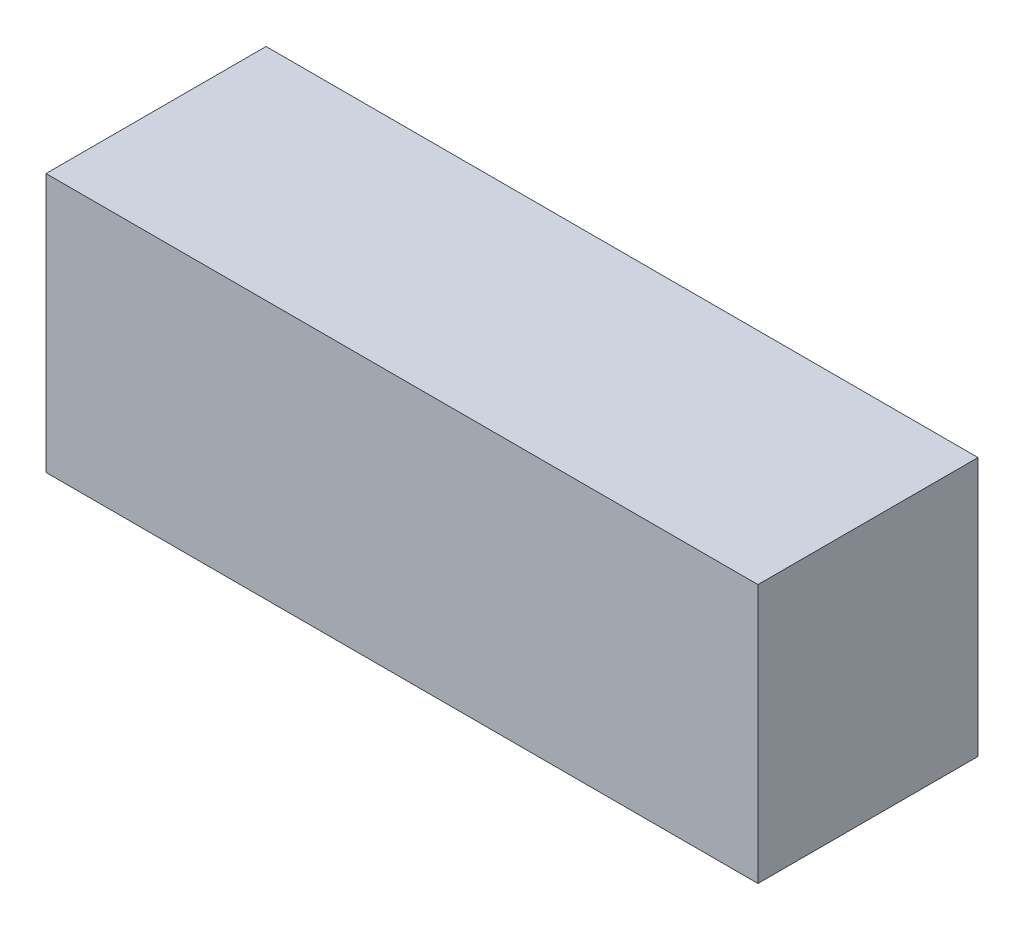
from build123d import *

# Parameters (mm, degrees)
SKETCH1_W           = 55
SKETCH1_H           = 17
BOSS_EXTRUDE1_DEPTH = 20


with BuildPart() as part:
    # Sketch1 → Boss-Extrude1 (new body)
    with BuildSketch(Plane(origin=(0, 0, 0), x_dir=(1, 0, 0), z_dir=(0, 1, 0))):
        Rectangle(SKETCH1_W, SKETCH1_H)
    extrude(amount=BOSS_EXTRUDE1_DEPTH)


solid = part.part
